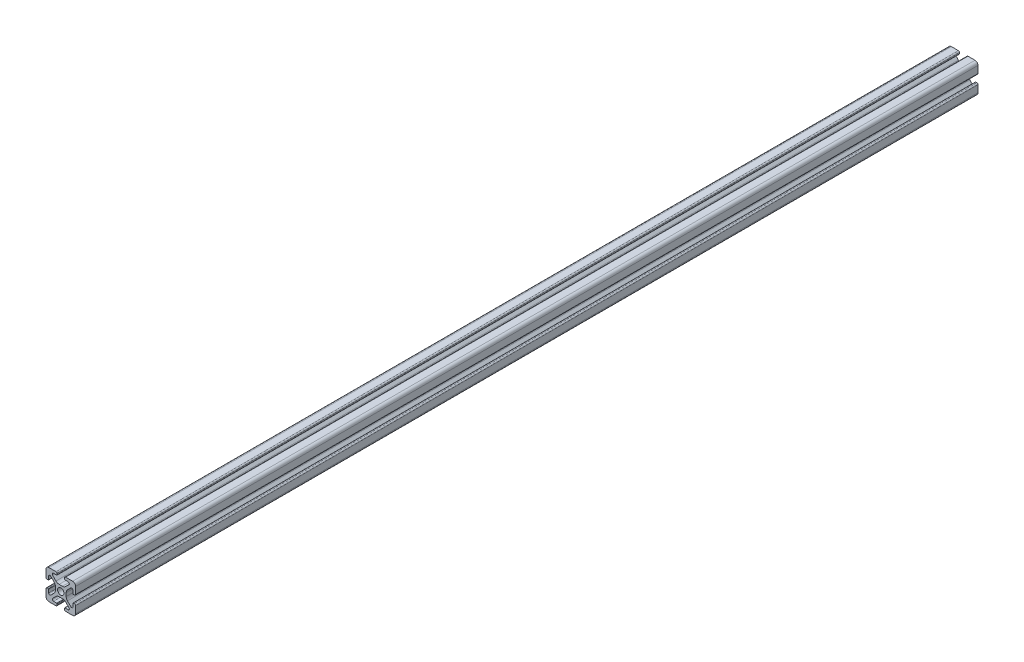
from build123d import *

# Parameters (mm, degrees)
SKETCH1_R           = 2.1463
BOSS_EXTRUDE1_DEPTH = 304.8


with BuildPart() as part:
    # Sketch1 → Boss-Extrude1 (new, symmetric)
    with BuildSketch(Plane.XY):
        with BuildLine():
            Line((-9.9949, 7.9883), (-9.9949, 3.2893))
            ThreePointArc((-9.9949, 3.2893), (-9.76427588, 2.73252412), (-9.2075, 2.5019))
            Line((-9.2075, 2.5019), (-8.4963, 2.5019))
            ThreePointArc((-8.4963, 2.5019), (-8.280773853, 2.591173853), (-8.1915, 2.8067))
            Line((-8.1915, 2.8067), (-8.1915, 4.9149))
            ThreePointArc((-8.1915, 4.9149), (-7.674065253, 5.689295824), (-6.760603096, 5.507596904))
            Line((-6.760603096, 5.507596904), (-4.505765747, 3.252759555))
            ThreePointArc((-4.505765747, 3.252759555), (-3.856054457, 2.280397894), (-3.627906192, 1.133419111))
            Line((-3.627906192, 1.133419111), (-3.627906192, -1.133419111))
            ThreePointArc((-3.627906192, -1.133419111), (-3.856054457, -2.280397894), (-4.505765747, -3.252759555))
            Line((-4.505765747, -3.252759555), (-6.760603096, -5.507596904))
            ThreePointArc((-6.760603096, -5.507596904), (-7.674065253, -5.689295824), (-8.1915, -4.9149))
            Line((-8.1915, -4.9149), (-8.1915, -2.8067))
            ThreePointArc((-8.1915, -2.8067), (-8.280773853, -2.591173853), (-8.4963, -2.5019))
            Line((-8.4963, -2.5019), (-9.2075, -2.5019))
            ThreePointArc((-9.2075, -2.5019), (-9.76427588, -2.73252412), (-9.9949, -3.2893))
            Line((-9.9949, -3.2893), (-9.9949, -7.9883))
            ThreePointArc((-9.9949, -7.9883), (-9.407180467, -9.407180467), (-7.9883, -9.9949))
            Line((-7.9883, -9.9949), (-3.2893, -9.9949))
            ThreePointArc((-3.2893, -9.9949), (-2.73252412, -9.76427588), (-2.5019, -9.2075))
            Line((-2.5019, -9.2075), (-2.5019, -8.4963))
            ThreePointArc((-2.5019, -8.4963), (-2.591173853, -8.280773853), (-2.8067, -8.1915))
            Line((-2.8067, -8.1915), (-4.9149, -8.1915))
            ThreePointArc((-4.9149, -8.1915), (-5.689295824, -7.674065253), (-5.507596904, -6.760603096))
            Line((-5.507596904, -6.760603096), (-3.252759555, -4.505765747))
            ThreePointArc((-3.252759555, -4.505765747), (-2.280397894, -3.856054457), (-1.133419111, -3.627906192))
            Line((-1.133419111, -3.627906192), (1.133419111, -3.627906192))
            ThreePointArc((1.133419111, -3.627906192), (2.280397894, -3.856054457), (3.252759555, -4.505765747))
            Line((3.252759555, -4.505765747), (5.507596904, -6.760603096))
            ThreePointArc((5.507596904, -6.760603096), (5.689295824, -7.674065253), (4.9149, -8.1915))
            Line((4.9149, -8.1915), (2.8067, -8.1915))
            ThreePointArc((2.8067, -8.1915), (2.591173853, -8.280773853), (2.5019, -8.4963))
            Line((2.5019, -8.4963), (2.5019, -9.2075))
            ThreePointArc((2.5019, -9.2075), (2.73252412, -9.76427588), (3.2893, -9.9949))
            Line((3.2893, -9.9949), (7.9883, -9.9949))
            ThreePointArc((7.9883, -9.9949), (9.407180467, -9.407180467), (9.9949, -7.9883))
            Line((9.9949, -7.9883), (9.9949, -3.2893))
            ThreePointArc((9.9949, -3.2893), (9.76427588, -2.73252412), (9.2075, -2.5019))
            Line((9.2075, -2.5019), (8.4963, -2.5019))
            ThreePointArc((8.4963, -2.5019), (8.280773853, -2.591173853), (8.1915, -2.8067))
            Line((8.1915, -2.8067), (8.1915, -4.9149))
            ThreePointArc((8.1915, -4.9149), (7.674065253, -5.689295824), (6.760603096, -5.507596904))
            Line((6.760603096, -5.507596904), (4.505765747, -3.252759555))
            ThreePointArc((4.505765747, -3.252759555), (3.856054457, -2.280397894), (3.627906192, -1.133419111))
            Line((3.627906192, -1.133419111), (3.627906192, 1.133419111))
            ThreePointArc((3.627906192, 1.133419111), (3.856054457, 2.280397894), (4.505765747, 3.252759555))
            Line((4.505765747, 3.252759555), (6.760603096, 5.507596904))
            ThreePointArc((6.760603096, 5.507596904), (7.674065253, 5.689295824), (8.1915, 4.9149))
            Line((8.1915, 4.9149), (8.1915, 2.8067))
            ThreePointArc((8.1915, 2.8067), (8.280773853, 2.591173853), (8.4963, 2.5019))
            Line((8.4963, 2.5019), (9.2075, 2.5019))
            ThreePointArc((9.2075, 2.5019), (9.76427588, 2.73252412), (9.9949, 3.2893))
            Line((9.9949, 3.2893), (9.9949, 7.9883))
            ThreePointArc((9.9949, 7.9883), (9.407180467, 9.407180467), (7.9883, 9.9949))
            Line((7.9883, 9.9949), (3.2893, 9.9949))
            ThreePointArc((3.2893, 9.9949), (2.73252412, 9.76427588), (2.5019, 9.2075))
            Line((2.5019, 9.2075), (2.5019, 8.4963))
            ThreePointArc((2.5019, 8.4963), (2.591173853, 8.280773853), (2.8067, 8.1915))
            Line((2.8067, 8.1915), (4.9149, 8.1915))
            ThreePointArc((4.9149, 8.1915), (5.689295824, 7.674065253), (5.507596904, 6.760603096))
            Line((5.507596904, 6.760603096), (3.252759555, 4.505765747))
            ThreePointArc((3.252759555, 4.505765747), (2.280397894, 3.856054457), (1.133419111, 3.627906192))
            Line((1.133419111, 3.627906192), (-1.133419111, 3.627906192))
            ThreePointArc((-1.133419111, 3.627906192), (-2.280397894, 3.856054457), (-3.252759555, 4.505765747))
            Line((-3.252759555, 4.505765747), (-5.507596904, 6.760603096))
            ThreePointArc((-5.507596904, 6.760603096), (-5.689295824, 7.674065253), (-4.9149, 8.1915))
            Line((-4.9149, 8.1915), (-2.8067, 8.1915))
            ThreePointArc((-2.8067, 8.1915), (-2.591173853, 8.280773853), (-2.5019, 8.4963))
            Line((-2.5019, 8.4963), (-2.5019, 9.2075))
            ThreePointArc((-2.5019, 9.2075), (-2.73252412, 9.76427588), (-3.2893, 9.9949))
            Line((-3.2893, 9.9949), (-7.9883, 9.9949))
            ThreePointArc((-7.9883, 9.9949), (-9.407180467, 9.407180467), (-9.9949, 7.9883))
        make_face()
        Circle(SKETCH1_R, mode=Mode.SUBTRACT)
    extrude(amount=BOSS_EXTRUDE1_DEPTH, both=True)


solid = part.part
